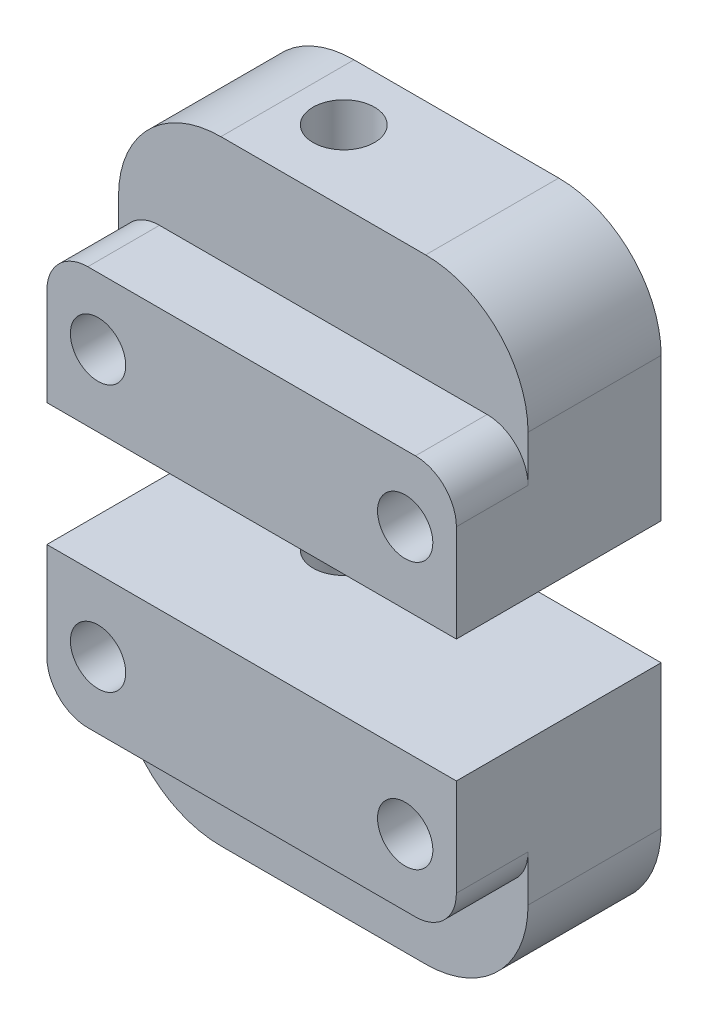
from build123d import *

# Parameters (mm, degrees)
SKETCH_1_W               = 20
SKETCH_1_H               = 10
SKETCH_1_R               = 1.5
EXTRUDE_1_DEPTH          = 15
CUT_EXTRUDE_3_DEPTH      = 21.615528128
CUT_EXTRUDE_3_DEPTH_BACK = 21.615528128
SKETCH_2_W               = 3.5
SKETCH_2_H               = 5.25
SKETCH_4_R               = 1.35
CUT_EXTRUDE_4_DEPTH      = 21.615528128
FILLET_1_R               = 5
FILLET_2_R               = 2
SKETCH_6_R               = 2.25
CUT_EXTRUDE_6_DEPTH      = 3
SKETCH_7_W               = 10
SKETCH_7_H               = 6
CUT_EXTRUDE_7_DEPTH      = 27.925824036


with BuildPart() as part:
    # 草图1 → 凸台-拉伸1 (new, symmetric)
    with BuildSketch(Plane(origin=(0, 0, 0), x_dir=(1, 0, 0), z_dir=(0, 1, 0))):
        with Locations((0, 5)):
            Rectangle(SKETCH_1_W, SKETCH_1_H)
        with Locations(Location((-2.5, 7, 0), (0, 0, 270))):
            Circle(SKETCH_1_R, mode=Mode.SUBTRACT)
    extrude(amount=EXTRUDE_1_DEPTH, both=True)

    # 草图2 → 切除-拉伸3 (cut, two sides: drawn at the far end of the back side and taken through both)
    with BuildSketch(Plane(origin=(0, 0, 0), x_dir=(0, 0, -1), z_dir=(1, 0, 0)).offset(-CUT_EXTRUDE_3_DEPTH_BACK)):
        with Locations((1.75, -12.375)):
            Rectangle(SKETCH_2_W, SKETCH_2_H)
        with Locations((1.75, 12.375)):
            Rectangle(SKETCH_2_W, SKETCH_2_H)
    extrude(amount=CUT_EXTRUDE_3_DEPTH + CUT_EXTRUDE_3_DEPTH_BACK, mode=Mode.SUBTRACT)

    # 草图4 → 切除-拉伸4 (cut, through all)
    with BuildSketch(Plane(origin=(0, 0, -10), x_dir=(-1, 0, 0), z_dir=(0, 0, -1))):
        with Locations((-7.5, -6.5)):
            Circle(SKETCH_4_R)
        with Locations(Location((7.5, -6.5, 0), (0, 0, 180))):
            Circle(SKETCH_4_R)
        with Locations((7.5, 6.5)):
            Circle(SKETCH_4_R)
        with Locations(Location((-7.5, 6.5, 0), (0, 0, 180))):
            Circle(SKETCH_4_R)
    extrude(amount=-CUT_EXTRUDE_4_DEPTH, mode=Mode.SUBTRACT)

    # 圆角1
    fillet_1_edges = [part.edges().sort_by_distance(p)[0] for p in [
        (-10, -15, -6.75),
        (10, -15, -6.75),
        (-10, 15, -6.75),
        (10, 15, -6.75),
    ]]
    fillet(fillet_1_edges, radius=FILLET_1_R)

    # 圆角2
    fillet_2_edges = [part.edges().sort_by_distance(p)[0] for p in [
        (10, -9.75, -1.75),
        (-10, -9.75, -1.75),
        (-10, 9.75, -1.75),
        (10, 9.75, -1.75),
    ]]
    fillet(fillet_2_edges, radius=FILLET_2_R)

    # 草图6 → 切除-拉伸6 (cut)
    with BuildSketch(Plane(origin=(0, 0, -10), x_dir=(-1, 0, 0), z_dir=(0, 0, -1))):
        with Locations((-7.5, 6.5)):
            Circle(SKETCH_6_R)
        with Locations(Location((-7.5, -6.5, 0), (0, 0, 180))):
            Circle(SKETCH_6_R)
        with Locations((7.5, -6.5)):
            Circle(SKETCH_6_R)
        with Locations(Location((7.5, 6.5, 0), (0, 0, 180))):
            Circle(SKETCH_6_R)
    extrude(amount=-CUT_EXTRUDE_6_DEPTH, mode=Mode.SUBTRACT)

    # 草图7 → 切除-拉伸7 (cut, through all)
    with BuildSketch(Plane.ZY.offset(10)):
        with Locations((-5, 0)):
            Rectangle(SKETCH_7_W, SKETCH_7_H)
    extrude(amount=-CUT_EXTRUDE_7_DEPTH, mode=Mode.SUBTRACT)


with BuildPart() as cut_extrude_7_piece_1:
    # of the separate pieces the step leaves, piece 1, a body of its own (cut_extrude_7_pieces)
    add(part.part.solids().sort_by_distance((10, 7.75, 0))[0])


with BuildPart() as cut_extrude_7_piece_2:
    # of the separate pieces the step leaves, piece 2, a body of its own (cut_extrude_7_pieces)
    add(part.part.solids().sort_by_distance((10, -3, -10))[0])


solid = Compound([cut_extrude_7_piece_1.part, cut_extrude_7_piece_2.part])
